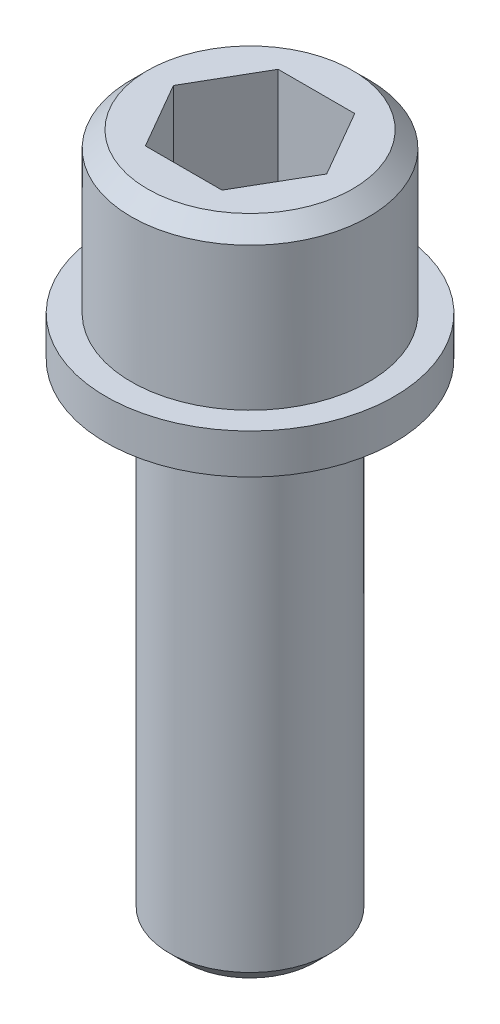
from build123d import *

# Parameters (mm, degrees)
CORTAR_EXTRUIR1_DEPTH = 6.35
CHAFL_N1_SIZE         = 0.9652


with BuildPart() as part:
    # Croquis1 → Revolución1 (revolve)
    with BuildSketch(Plane.XY, mode=Mode.PRIVATE) as revoluci_n1_sk:
        Polygon((0, 41.275), (7.112, 41.275), (7.112, 31.75), (8.636, 31.75), (8.636, 29.3624), (4.826, 29.3624), (4.826, 0), (0, 0), align=None)
    revolve(revoluci_n1_sk.sketch.rotate(Axis((0, 0, 0), (0, 1, 0)), 90), axis=Axis((0, 0, 0), (0, 1, 0)))

    # Croquis2 → Cortar-Extruir1 (cut)
    with BuildSketch(Plane(origin=(0, 41.275, 0), x_dir=(1, 0, 0), z_dir=(0, 1, 0))):
        Polygon((-2.295025055, 3.9751), (-4.59005011, 0), (-2.295025055, -3.9751), (2.295025055, -3.9751), (4.59005011, 0), (2.295025055, 3.9751), align=None)
    extrude(amount=-CORTAR_EXTRUIR1_DEPTH, mode=Mode.SUBTRACT)

    # Chaflán1
    chafl_n1_edges = [part.edges().sort_by_distance(p)[0] for p in [
        (0, 0, 4.826),
        (0, 41.275, 7.112),
    ]]
    chamfer(chafl_n1_edges, length=CHAFL_N1_SIZE)


solid = part.part
